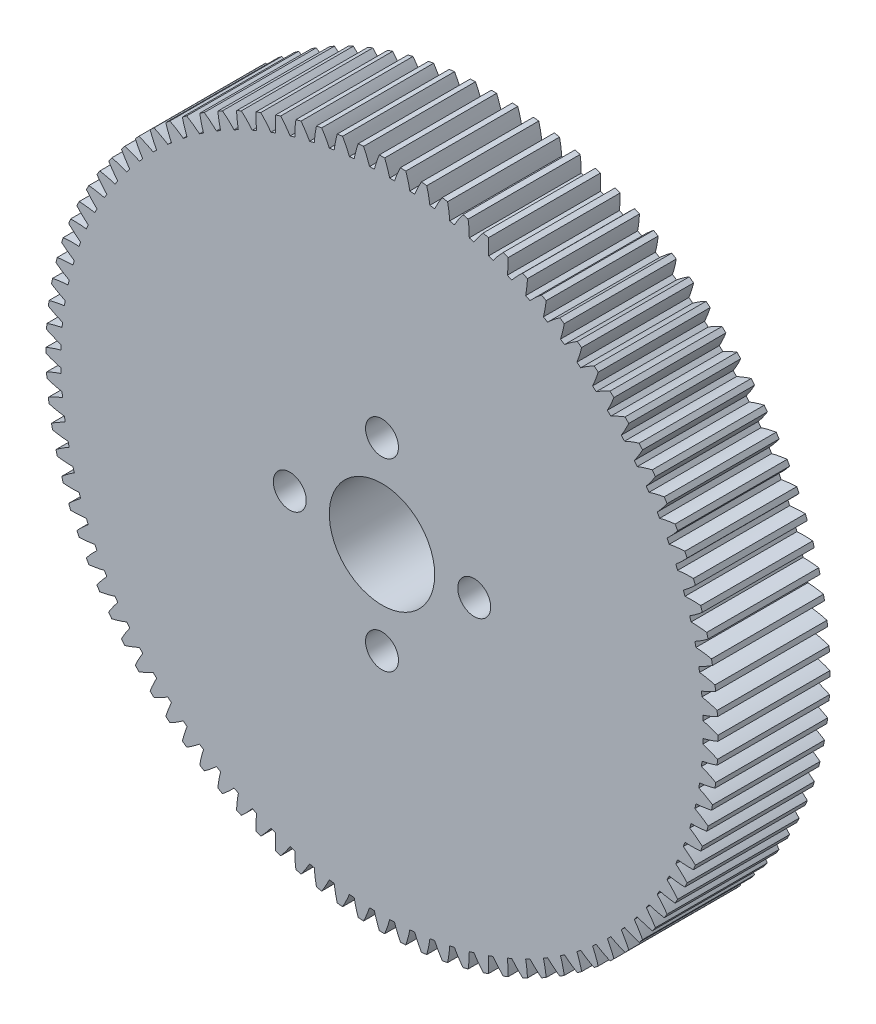
from build123d import *

# Parameters (mm, degrees)
BOSS_EXTRUDE1_DEPTH = 8.5
SKETCH2_R           = 4
SKETCH2_R_2         = 1.25
CUT_EXTRUDE1_DEPTH  = 38.0495419


with BuildPart() as part:
    # Sketch1 → Boss-Extrude1 (new body)
    with BuildSketch(Plane.XY.offset(4)):
        with BuildLine():
            Line((25.499201507, -0.201798183), (25.499201507, 0.201798183))
            ThreePointArc((25.499201507, 0.201798183), (24.94053741, 0.412222952), (24.368062617, 0.581506053))
            ThreePointArc((24.368062617, 0.581506053), (24.362972409, 0.765637253), (24.356490879, 0.949724728))
            ThreePointArc((24.356490879, 0.949724728), (24.917148309, 1.154763051), (25.46155567, 1.39970813))
            Line((25.46155567, 1.39970813), (25.436213645, 1.802508091))
            ThreePointArc((25.436213645, 1.802508091), (24.865439263, 1.977438825), (24.283464745, 2.110441895))
            ThreePointArc((24.283464745, 2.110441895), (24.266822887, 2.293890137), (24.248795199, 2.47720738))
            ThreePointArc((24.248795199, 2.47720738), (24.795471836, 2.717045077), (25.323424706, 2.995690434))
            Line((25.323424706, 2.995690434), (25.272840668, 3.396104322))
            ThreePointArc((25.272840668, 3.396104322), (24.692208588, 3.534850651), (24.103031131, 3.631048787))
            ThreePointArc((24.103031131, 3.631048787), (24.074903302, 3.813090085), (24.045400602, 3.994913625))
            ThreePointArc((24.045400602, 3.994913625), (24.575938965, 4.268604168), (25.085353753, 4.579850117))
            Line((25.085353753, 4.579850117), (25.009727335, 4.976297682))
            ThreePointArc((25.009727335, 4.976297682), (24.421529045, 5.078312037), (23.827473865, 5.137325589))
            ThreePointArc((23.827473865, 5.137325589), (23.787971072, 5.317241509), (23.747109795, 5.496853772))
            ThreePointArc((23.747109795, 5.496853772), (24.25941609, 5.803317028), (24.748282369, 6.145935223))
            Line((24.748282369, 6.145935223), (24.647912034, 6.536851868))
            ThreePointArc((24.647912034, 6.536851868), (24.054468885, 6.601731644), (23.457880446, 6.623327714))
            ThreePointArc((23.457880446, 6.623327714), (23.407158588, 6.80040821), (23.355099994, 6.977100348))
            ThreePointArc((23.355099994, 6.977100348), (23.847152382, 7.315126847), (24.313540822, 7.687765132))
            Line((24.313540822, 7.687765132), (24.188822685, 8.071608086))
            ThreePointArc((24.188822685, 8.071608086), (23.592476726, 8.099097233), (22.995709489, 8.083190589))
            ThreePointArc((22.995709489, 8.083190589), (22.933968743, 8.256736806), (22.870918284, 8.429811496))
            ThreePointArc((22.870918284, 8.429811496), (23.340774859, 8.798067203), (23.782844836, 9.199254943))
            Line((23.782844836, 9.199254943), (23.634271104, 9.574509354))
            ThreePointArc((23.634271104, 9.574509354), (23.037375839, 9.564499385), (22.442784972, 9.511152805))
            ThreePointArc((22.442784972, 9.511152805), (22.370269001, 9.680479834), (22.296475507, 9.84925403))
            ThreePointArc((22.296475507, 9.84925403), (22.742281961, 10.246285607), (23.158288827, 10.674439498))
            Line((23.158288827, 10.674439498), (22.986445852, 11.039624408))
            ThreePointArc((22.986445852, 11.039624408), (22.391356955, 10.992154828), (21.801289037, 10.901578846))
            ThreePointArc((21.801289037, 10.901578846), (21.718284027, 11.066018431), (21.634038729, 11.229826058))
            ThreePointArc((21.634038729, 11.229826058), (22.054035666, 11.654066602), (22.442337633, 12.107496917))
            Line((22.442337633, 12.107496917), (22.2479036, 12.461171109))
            ThreePointArc((22.2479036, 12.461171109), (21.656969615, 12.376429258), (21.073753374, 12.248981335))
            ThreePointArc((21.073753374, 12.248981335), (20.980586908, 12.407884509), (20.886222283, 12.566079093))
            ThreePointArc((20.886222283, 12.566079093), (21.278752168, 13.015854321), (21.637816784, 13.492771577))
            Line((21.637816784, 13.492771577), (21.421559037, 13.833539259))
            ThreePointArc((21.421559037, 13.833539259), (20.837112109, 13.711859575), (20.263049233, 13.548042691))
            ThreePointArc((20.263049233, 13.548042691), (20.160088998, 13.700782335), (20.055977459, 13.852739554))
            ThreePointArc((20.055977459, 13.852739554), (20.419491156, 14.326274409), (20.747901358, 14.824796431))
            Line((20.747901358, 14.824796431), (20.510673366, 15.151312751))
            ThreePointArc((20.510673366, 15.151312751), (19.935020042, 14.993175447), (19.372376095, 14.793636112))
            ThreePointArc((19.372376095, 14.793636112), (19.260028427, 14.939609433), (19.146580856, 15.084729581))
            ThreePointArc((19.146580856, 15.084729581), (19.479643742, 15.580155238), (19.776103444, 16.098314587))
            Line((19.776103444, 16.098314587), (19.518841438, 16.409290932))
            ThreePointArc((19.518841438, 16.409290932), (18.954253558, 16.215320106), (18.405249039, 15.98084581))
            ThreePointArc((18.405249039, 15.98084581), (18.283957322, 16.119476717), (18.161621444, 16.257187072))
            ThreePointArc((18.161621444, 16.257187072), (18.462919073, 16.772548311), (18.726258285, 17.30830005))
            Line((18.726258285, 17.30830005), (18.449977561, 17.60250914))
            ThreePointArc((18.449977561, 17.60250914), (17.898683294, 17.373470304), (17.365484873, 17.104986411))
            ThreePointArc((17.365484873, 17.104986411), (17.235727791, 17.235727791), (17.104986411, 17.365484873))
            ThreePointArc((17.104986411, 17.365484873), (17.373329697, 17.898747799), (17.60250914, 18.449977561))
            Line((17.60250914, 18.449977561), (17.30830005, 18.726258285))
            ThreePointArc((17.30830005, 18.726258285), (16.772475105, 18.463055352), (16.257187072, 18.161621444))
            ThreePointArc((16.257187072, 18.161621444), (16.119476717, 18.283957322), (15.98084581, 18.405249039))
            ThreePointArc((15.98084581, 18.405249039), (16.215175727, 18.954309106), (16.409290932, 19.518841438))
            Line((16.409290932, 19.518841438), (16.098314587, 19.776103444))
            ThreePointArc((16.098314587, 19.776103444), (15.580073619, 19.479775155), (15.084729581, 19.146580856))
            ThreePointArc((15.084729581, 19.146580856), (14.939609433, 19.260028427), (14.793636112, 19.372376095))
            ThreePointArc((14.793636112, 19.372376095), (14.993027865, 19.935066415), (15.151312751, 20.510673366))
            Line((15.151312751, 20.510673366), (14.824796431, 20.747901358))
            ThreePointArc((14.824796431, 20.747901358), (14.3261847, 20.419617185), (13.852739554, 20.055977459))
            ThreePointArc((13.852739554, 20.055977459), (13.700782335, 20.160088998), (13.548042691, 20.263049233))
            ThreePointArc((13.548042691, 20.263049233), (13.711709373, 20.837149124), (13.833539259, 21.421559037))
            Line((13.833539259, 21.421559037), (13.492771577, 21.637816784))
            ThreePointArc((13.492771577, 21.637816784), (13.015756876, 21.278872315), (12.566079093, 20.886222283))
            ThreePointArc((12.566079093, 20.886222283), (12.407884509, 20.980586908), (12.248981335, 21.073753374))
            ThreePointArc((12.248981335, 21.073753374), (12.376277027, 21.656997125), (12.461171109, 22.2479036))
            Line((12.461171109, 22.2479036), (12.107496917, 22.442337633))
            ThreePointArc((12.107496917, 22.442337633), (11.653961805, 22.054149458), (11.229826058, 21.634038729))
            ThreePointArc((11.229826058, 21.634038729), (11.066018431, 21.718284027), (10.901578846, 21.801289037))
            ThreePointArc((10.901578846, 21.801289037), (10.992001171, 22.391374853), (11.039624408, 22.986445852))
            Line((11.039624408, 22.986445852), (10.674439498, 23.158288827))
            ThreePointArc((10.674439498, 23.158288827), (10.246173871, 22.742388948), (9.84925403, 22.296475507))
            ThreePointArc((9.84925403, 22.296475507), (9.680479834, 22.370269001), (9.511152805, 22.442784972))
            ThreePointArc((9.511152805, 22.442784972), (9.564344907, 23.037384054), (9.574509354, 23.634271104))
            Line((9.574509354, 23.634271104), (9.199254943, 23.782844836))
            ThreePointArc((9.199254943, 23.782844836), (8.79794897, 23.340874619), (8.429811496, 22.870918284))
            ThreePointArc((8.429811496, 22.870918284), (8.256736806, 22.933968743), (8.083190589, 22.995709489))
            ThreePointArc((8.083190589, 22.995709489), (8.098942544, 23.592475224), (8.071608086, 24.188822685))
            Line((8.071608086, 24.188822685), (7.687765132, 24.313540822))
            ThreePointArc((7.687765132, 24.313540822), (7.315002584, 23.847244521), (6.977100348, 23.355099994))
            ThreePointArc((6.977100348, 23.355099994), (6.80040821, 23.407158588), (6.623327714, 23.457880446))
            ThreePointArc((6.623327714, 23.457880446), (6.601577355, 24.054457674), (6.536851868, 24.647912034))
            Line((6.536851868, 24.647912034), (6.145935223, 24.748282369))
            ThreePointArc((6.145935223, 24.748282369), (5.803187224, 24.259500244), (5.496853772, 23.747109795))
            ThreePointArc((5.496853772, 23.747109795), (5.317241509, 23.787971072), (5.137325589, 23.827473865))
            ThreePointArc((5.137325589, 23.827473865), (5.078158755, 24.421508168), (4.976297682, 25.009727335))
            Line((4.976297682, 25.009727335), (4.579850117, 25.085353753))
            ThreePointArc((4.579850117, 25.085353753), (4.268469336, 24.576014803), (3.994913625, 24.045400602))
            ThreePointArc((3.994913625, 24.045400602), (3.813090085, 24.074903302), (3.631048787, 24.103031131))
            ThreePointArc((3.631048787, 24.103031131), (3.534698983, 24.692178127), (3.396104322, 25.272840668))
            Line((3.396104322, 25.272840668), (2.995690434, 25.323424706))
            ThreePointArc((2.995690434, 25.323424706), (2.71690575, 24.795539059), (2.47720738, 24.248795199))
            ThreePointArc((2.47720738, 24.248795199), (2.293890137, 24.266822887), (2.110441895, 24.283464745))
            ThreePointArc((2.110441895, 24.283464745), (1.97728937, 24.865399339), (1.802508091, 25.436213645))
            Line((1.802508091, 25.436213645), (1.39970813, 25.46155567))
            ThreePointArc((1.39970813, 25.46155567), (1.154619777, 24.91720665), (0.949724728, 24.356490879))
            ThreePointArc((0.949724728, 24.356490879), (0.765637253, 24.362972409), (0.581506053, 24.368062617))
            ThreePointArc((0.581506053, 24.368062617), (0.412076298, 24.94048818), (0.201798183, 25.499201507))
            Line((0.201798183, 25.499201507), (-0.201798183, 25.499201507))
            ThreePointArc((-0.201798183, 25.499201507), (-0.412222952, 24.94053741), (-0.581506053, 24.368062617))
            ThreePointArc((-0.581506053, 24.368062617), (-0.765637253, 24.362972409), (-0.949724728, 24.356490879))
            ThreePointArc((-0.949724728, 24.356490879), (-1.154763051, 24.917148309), (-1.39970813, 25.46155567))
            Line((-1.39970813, 25.46155567), (-1.802508091, 25.436213645))
            ThreePointArc((-1.802508091, 25.436213645), (-1.977438825, 24.865439263), (-2.110441895, 24.283464745))
            ThreePointArc((-2.110441895, 24.283464745), (-2.293890137, 24.266822887), (-2.47720738, 24.248795199))
            ThreePointArc((-2.47720738, 24.248795199), (-2.717045077, 24.795471836), (-2.995690434, 25.323424706))
            Line((-2.995690434, 25.323424706), (-3.396104322, 25.272840668))
            ThreePointArc((-3.396104322, 25.272840668), (-3.534850651, 24.692208588), (-3.631048787, 24.103031131))
            ThreePointArc((-3.631048787, 24.103031131), (-3.813090085, 24.074903302), (-3.994913625, 24.045400602))
            ThreePointArc((-3.994913625, 24.045400602), (-4.268604168, 24.575938965), (-4.579850117, 25.085353753))
            Line((-4.579850117, 25.085353753), (-4.976297682, 25.009727335))
            ThreePointArc((-4.976297682, 25.009727335), (-5.078312037, 24.421529045), (-5.137325589, 23.827473865))
            ThreePointArc((-5.137325589, 23.827473865), (-5.317241509, 23.787971072), (-5.496853772, 23.747109795))
            ThreePointArc((-5.496853772, 23.747109795), (-5.803317028, 24.25941609), (-6.145935223, 24.748282369))
            Line((-6.145935223, 24.748282369), (-6.536851868, 24.647912034))
            ThreePointArc((-6.536851868, 24.647912034), (-6.601731644, 24.054468885), (-6.623327714, 23.457880446))
            ThreePointArc((-6.623327714, 23.457880446), (-6.80040821, 23.407158588), (-6.977100348, 23.355099994))
            ThreePointArc((-6.977100348, 23.355099994), (-7.315126847, 23.847152382), (-7.687765132, 24.313540822))
            Line((-7.687765132, 24.313540822), (-8.071608086, 24.188822685))
            ThreePointArc((-8.071608086, 24.188822685), (-8.099097233, 23.592476726), (-8.083190589, 22.995709489))
            ThreePointArc((-8.083190589, 22.995709489), (-8.256736806, 22.933968743), (-8.429811496, 22.870918284))
            ThreePointArc((-8.429811496, 22.870918284), (-8.798067203, 23.340774859), (-9.199254943, 23.782844836))
            Line((-9.199254943, 23.782844836), (-9.574509354, 23.634271104))
            ThreePointArc((-9.574509354, 23.634271104), (-9.564499385, 23.037375839), (-9.511152805, 22.442784972))
            ThreePointArc((-9.511152805, 22.442784972), (-9.680479834, 22.370269001), (-9.84925403, 22.296475507))
            ThreePointArc((-9.84925403, 22.296475507), (-10.246285607, 22.742281961), (-10.674439498, 23.158288827))
            Line((-10.674439498, 23.158288827), (-11.039624408, 22.986445852))
            ThreePointArc((-11.039624408, 22.986445852), (-10.992154828, 22.391356955), (-10.901578846, 21.801289037))
            ThreePointArc((-10.901578846, 21.801289037), (-11.066018431, 21.718284027), (-11.229826058, 21.634038729))
            ThreePointArc((-11.229826058, 21.634038729), (-11.654066602, 22.054035666), (-12.107496917, 22.442337633))
            Line((-12.107496917, 22.442337633), (-12.461171109, 22.2479036))
            ThreePointArc((-12.461171109, 22.2479036), (-12.376429258, 21.656969615), (-12.248981335, 21.073753374))
            ThreePointArc((-12.248981335, 21.073753374), (-12.407884509, 20.980586908), (-12.566079093, 20.886222283))
            ThreePointArc((-12.566079093, 20.886222283), (-13.015854321, 21.278752168), (-13.492771577, 21.637816784))
            Line((-13.492771577, 21.637816784), (-13.833539259, 21.421559037))
            ThreePointArc((-13.833539259, 21.421559037), (-13.711859575, 20.837112109), (-13.548042691, 20.263049233))
            ThreePointArc((-13.548042691, 20.263049233), (-13.700782335, 20.160088998), (-13.852739554, 20.055977459))
            ThreePointArc((-13.852739554, 20.055977459), (-14.326274409, 20.419491156), (-14.824796431, 20.747901358))
            Line((-14.824796431, 20.747901358), (-15.151312751, 20.510673366))
            ThreePointArc((-15.151312751, 20.510673366), (-14.993175447, 19.935020042), (-14.793636112, 19.372376095))
            ThreePointArc((-14.793636112, 19.372376095), (-14.939609433, 19.260028427), (-15.084729581, 19.146580856))
            ThreePointArc((-15.084729581, 19.146580856), (-15.580155238, 19.479643742), (-16.098314587, 19.776103444))
            Line((-16.098314587, 19.776103444), (-16.409290932, 19.518841438))
            ThreePointArc((-16.409290932, 19.518841438), (-16.215320106, 18.954253558), (-15.98084581, 18.405249039))
            ThreePointArc((-15.98084581, 18.405249039), (-16.119476717, 18.283957322), (-16.257187072, 18.161621444))
            ThreePointArc((-16.257187072, 18.161621444), (-16.772548311, 18.462919073), (-17.30830005, 18.726258285))
            Line((-17.30830005, 18.726258285), (-17.60250914, 18.449977561))
            ThreePointArc((-17.60250914, 18.449977561), (-17.373470304, 17.898683294), (-17.104986411, 17.365484873))
            ThreePointArc((-17.104986411, 17.365484873), (-17.235727791, 17.235727791), (-17.365484873, 17.104986411))
            ThreePointArc((-17.365484873, 17.104986411), (-17.898747799, 17.373329697), (-18.449977561, 17.60250914))
            Line((-18.449977561, 17.60250914), (-18.726258285, 17.30830005))
            ThreePointArc((-18.726258285, 17.30830005), (-18.463055352, 16.772475105), (-18.161621444, 16.257187072))
            ThreePointArc((-18.161621444, 16.257187072), (-18.283957322, 16.119476717), (-18.405249039, 15.98084581))
            ThreePointArc((-18.405249039, 15.98084581), (-18.954309106, 16.215175727), (-19.518841438, 16.409290932))
            Line((-19.518841438, 16.409290932), (-19.776103444, 16.098314587))
            ThreePointArc((-19.776103444, 16.098314587), (-19.479775155, 15.580073619), (-19.146580856, 15.084729581))
            ThreePointArc((-19.146580856, 15.084729581), (-19.260028427, 14.939609433), (-19.372376095, 14.793636112))
            ThreePointArc((-19.372376095, 14.793636112), (-19.935066415, 14.993027865), (-20.510673366, 15.151312751))
            Line((-20.510673366, 15.151312751), (-20.747901358, 14.824796431))
            ThreePointArc((-20.747901358, 14.824796431), (-20.419617185, 14.3261847), (-20.055977459, 13.852739554))
            ThreePointArc((-20.055977459, 13.852739554), (-20.160088998, 13.700782335), (-20.263049233, 13.548042691))
            ThreePointArc((-20.263049233, 13.548042691), (-20.837149124, 13.711709373), (-21.421559037, 13.833539259))
            Line((-21.421559037, 13.833539259), (-21.637816784, 13.492771577))
            ThreePointArc((-21.637816784, 13.492771577), (-21.278872315, 13.015756876), (-20.886222283, 12.566079093))
            ThreePointArc((-20.886222283, 12.566079093), (-20.980586908, 12.407884509), (-21.073753374, 12.248981335))
            ThreePointArc((-21.073753374, 12.248981335), (-21.656997125, 12.376277027), (-22.2479036, 12.461171109))
            Line((-22.2479036, 12.461171109), (-22.442337633, 12.107496917))
            ThreePointArc((-22.442337633, 12.107496917), (-22.054149458, 11.653961805), (-21.634038729, 11.229826058))
            ThreePointArc((-21.634038729, 11.229826058), (-21.718284027, 11.066018431), (-21.801289037, 10.901578846))
            ThreePointArc((-21.801289037, 10.901578846), (-22.391374853, 10.992001171), (-22.986445852, 11.039624408))
            Line((-22.986445852, 11.039624408), (-23.158288827, 10.674439498))
            ThreePointArc((-23.158288827, 10.674439498), (-22.742388948, 10.246173871), (-22.296475507, 9.84925403))
            ThreePointArc((-22.296475507, 9.84925403), (-22.370269001, 9.680479834), (-22.442784972, 9.511152805))
            ThreePointArc((-22.442784972, 9.511152805), (-23.037384054, 9.564344907), (-23.634271104, 9.574509354))
            Line((-23.634271104, 9.574509354), (-23.782844836, 9.199254943))
            ThreePointArc((-23.782844836, 9.199254943), (-23.340874619, 8.79794897), (-22.870918284, 8.429811496))
            ThreePointArc((-22.870918284, 8.429811496), (-22.933968743, 8.256736806), (-22.995709489, 8.083190589))
            ThreePointArc((-22.995709489, 8.083190589), (-23.592475224, 8.098942544), (-24.188822685, 8.071608086))
            Line((-24.188822685, 8.071608086), (-24.313540822, 7.687765132))
            ThreePointArc((-24.313540822, 7.687765132), (-23.847244521, 7.315002584), (-23.355099994, 6.977100348))
            ThreePointArc((-23.355099994, 6.977100348), (-23.407158588, 6.80040821), (-23.457880446, 6.623327714))
            ThreePointArc((-23.457880446, 6.623327714), (-24.054457674, 6.601577355), (-24.647912034, 6.536851868))
            Line((-24.647912034, 6.536851868), (-24.748282369, 6.145935223))
            ThreePointArc((-24.748282369, 6.145935223), (-24.259500244, 5.803187224), (-23.747109795, 5.496853772))
            ThreePointArc((-23.747109795, 5.496853772), (-23.787971072, 5.317241509), (-23.827473865, 5.137325589))
            ThreePointArc((-23.827473865, 5.137325589), (-24.421508168, 5.078158755), (-25.009727335, 4.976297682))
            Line((-25.009727335, 4.976297682), (-25.085353753, 4.579850117))
            ThreePointArc((-25.085353753, 4.579850117), (-24.576014803, 4.268469336), (-24.045400602, 3.994913625))
            ThreePointArc((-24.045400602, 3.994913625), (-24.074903302, 3.813090085), (-24.103031131, 3.631048787))
            ThreePointArc((-24.103031131, 3.631048787), (-24.692178127, 3.534698983), (-25.272840668, 3.396104322))
            Line((-25.272840668, 3.396104322), (-25.323424706, 2.995690434))
            ThreePointArc((-25.323424706, 2.995690434), (-24.795539059, 2.71690575), (-24.248795199, 2.47720738))
            ThreePointArc((-24.248795199, 2.47720738), (-24.266822887, 2.293890137), (-24.283464745, 2.110441895))
            ThreePointArc((-24.283464745, 2.110441895), (-24.865399339, 1.97728937), (-25.436213645, 1.802508091))
            Line((-25.436213645, 1.802508091), (-25.46155567, 1.39970813))
            ThreePointArc((-25.46155567, 1.39970813), (-24.91720665, 1.154619777), (-24.356490879, 0.949724728))
            ThreePointArc((-24.356490879, 0.949724728), (-24.362972409, 0.765637253), (-24.368062617, 0.581506053))
            ThreePointArc((-24.368062617, 0.581506053), (-24.94048818, 0.412076298), (-25.499201507, 0.201798183))
            Line((-25.499201507, 0.201798183), (-25.499201507, -0.201798183))
            ThreePointArc((-25.499201507, -0.201798183), (-24.94053741, -0.412222952), (-24.368062617, -0.581506053))
            ThreePointArc((-24.368062617, -0.581506053), (-24.362972409, -0.765637253), (-24.356490879, -0.949724728))
            ThreePointArc((-24.356490879, -0.949724728), (-24.917148309, -1.154763051), (-25.46155567, -1.39970813))
            Line((-25.46155567, -1.39970813), (-25.436213645, -1.802508091))
            ThreePointArc((-25.436213645, -1.802508091), (-24.865439263, -1.977438825), (-24.283464745, -2.110441895))
            ThreePointArc((-24.283464745, -2.110441895), (-24.266822887, -2.293890137), (-24.248795199, -2.47720738))
            ThreePointArc((-24.248795199, -2.47720738), (-24.795471836, -2.717045077), (-25.323424706, -2.995690434))
            Line((-25.323424706, -2.995690434), (-25.272840668, -3.396104322))
            ThreePointArc((-25.272840668, -3.396104322), (-24.692208588, -3.534850651), (-24.103031131, -3.631048787))
            ThreePointArc((-24.103031131, -3.631048787), (-24.074903302, -3.813090085), (-24.045400602, -3.994913625))
            ThreePointArc((-24.045400602, -3.994913625), (-24.575938965, -4.268604168), (-25.085353753, -4.579850117))
            Line((-25.085353753, -4.579850117), (-25.009727335, -4.976297682))
            ThreePointArc((-25.009727335, -4.976297682), (-24.421529045, -5.078312037), (-23.827473865, -5.137325589))
            ThreePointArc((-23.827473865, -5.137325589), (-23.787971072, -5.317241509), (-23.747109795, -5.496853772))
            ThreePointArc((-23.747109795, -5.496853772), (-24.25941609, -5.803317028), (-24.748282369, -6.145935223))
            Line((-24.748282369, -6.145935223), (-24.647912034, -6.536851868))
            ThreePointArc((-24.647912034, -6.536851868), (-24.054468885, -6.601731644), (-23.457880446, -6.623327714))
            ThreePointArc((-23.457880446, -6.623327714), (-23.407158588, -6.80040821), (-23.355099994, -6.977100348))
            ThreePointArc((-23.355099994, -6.977100348), (-23.847152382, -7.315126847), (-24.313540822, -7.687765132))
            Line((-24.313540822, -7.687765132), (-24.188822685, -8.071608086))
            ThreePointArc((-24.188822685, -8.071608086), (-23.592476726, -8.099097233), (-22.995709489, -8.083190589))
            ThreePointArc((-22.995709489, -8.083190589), (-22.933968743, -8.256736806), (-22.870918284, -8.429811496))
            ThreePointArc((-22.870918284, -8.429811496), (-23.340774859, -8.798067203), (-23.782844836, -9.199254943))
            Line((-23.782844836, -9.199254943), (-23.634271104, -9.574509354))
            ThreePointArc((-23.634271104, -9.574509354), (-23.037375839, -9.564499385), (-22.442784972, -9.511152805))
            ThreePointArc((-22.442784972, -9.511152805), (-22.370269001, -9.680479834), (-22.296475507, -9.84925403))
            ThreePointArc((-22.296475507, -9.84925403), (-22.742281961, -10.246285607), (-23.158288827, -10.674439498))
            Line((-23.158288827, -10.674439498), (-22.986445852, -11.039624408))
            ThreePointArc((-22.986445852, -11.039624408), (-22.391356955, -10.992154828), (-21.801289037, -10.901578846))
            ThreePointArc((-21.801289037, -10.901578846), (-21.718284027, -11.066018431), (-21.634038729, -11.229826058))
            ThreePointArc((-21.634038729, -11.229826058), (-22.054035666, -11.654066602), (-22.442337633, -12.107496917))
            Line((-22.442337633, -12.107496917), (-22.2479036, -12.461171109))
            ThreePointArc((-22.2479036, -12.461171109), (-21.656969615, -12.376429258), (-21.073753374, -12.248981335))
            ThreePointArc((-21.073753374, -12.248981335), (-20.980586908, -12.407884509), (-20.886222283, -12.566079093))
            ThreePointArc((-20.886222283, -12.566079093), (-21.278752168, -13.015854321), (-21.637816784, -13.492771577))
            Line((-21.637816784, -13.492771577), (-21.421559037, -13.833539259))
            ThreePointArc((-21.421559037, -13.833539259), (-20.837112109, -13.711859575), (-20.263049233, -13.548042691))
            ThreePointArc((-20.263049233, -13.548042691), (-20.160088998, -13.700782335), (-20.055977459, -13.852739554))
            ThreePointArc((-20.055977459, -13.852739554), (-20.419491156, -14.326274409), (-20.747901358, -14.824796431))
            Line((-20.747901358, -14.824796431), (-20.510673366, -15.151312751))
            ThreePointArc((-20.510673366, -15.151312751), (-19.935020042, -14.993175447), (-19.372376095, -14.793636112))
            ThreePointArc((-19.372376095, -14.793636112), (-19.260028427, -14.939609433), (-19.146580856, -15.084729581))
            ThreePointArc((-19.146580856, -15.084729581), (-19.479643742, -15.580155238), (-19.776103444, -16.098314587))
            Line((-19.776103444, -16.098314587), (-19.518841438, -16.409290932))
            ThreePointArc((-19.518841438, -16.409290932), (-18.954253558, -16.215320106), (-18.405249039, -15.98084581))
            ThreePointArc((-18.405249039, -15.98084581), (-18.283957322, -16.119476717), (-18.161621444, -16.257187072))
            ThreePointArc((-18.161621444, -16.257187072), (-18.462919073, -16.772548311), (-18.726258285, -17.30830005))
            Line((-18.726258285, -17.30830005), (-18.449977561, -17.60250914))
            ThreePointArc((-18.449977561, -17.60250914), (-17.898683294, -17.373470304), (-17.365484873, -17.104986411))
            ThreePointArc((-17.365484873, -17.104986411), (-17.235727791, -17.235727791), (-17.104986411, -17.365484873))
            ThreePointArc((-17.104986411, -17.365484873), (-17.373329697, -17.898747799), (-17.60250914, -18.449977561))
            Line((-17.60250914, -18.449977561), (-17.30830005, -18.726258285))
            ThreePointArc((-17.30830005, -18.726258285), (-16.772475105, -18.463055352), (-16.257187072, -18.161621444))
            ThreePointArc((-16.257187072, -18.161621444), (-16.119476717, -18.283957322), (-15.98084581, -18.405249039))
            ThreePointArc((-15.98084581, -18.405249039), (-16.215175727, -18.954309106), (-16.409290932, -19.518841438))
            Line((-16.409290932, -19.518841438), (-16.098314587, -19.776103444))
            ThreePointArc((-16.098314587, -19.776103444), (-15.580073619, -19.479775155), (-15.084729581, -19.146580856))
            ThreePointArc((-15.084729581, -19.146580856), (-14.939609433, -19.260028427), (-14.793636112, -19.372376095))
            ThreePointArc((-14.793636112, -19.372376095), (-14.993027865, -19.935066415), (-15.151312751, -20.510673366))
            Line((-15.151312751, -20.510673366), (-14.824796431, -20.747901358))
            ThreePointArc((-14.824796431, -20.747901358), (-14.3261847, -20.419617185), (-13.852739554, -20.055977459))
            ThreePointArc((-13.852739554, -20.055977459), (-13.700782335, -20.160088998), (-13.548042691, -20.263049233))
            ThreePointArc((-13.548042691, -20.263049233), (-13.711709373, -20.837149124), (-13.833539259, -21.421559037))
            Line((-13.833539259, -21.421559037), (-13.492771577, -21.637816784))
            ThreePointArc((-13.492771577, -21.637816784), (-13.015756876, -21.278872315), (-12.566079093, -20.886222283))
            ThreePointArc((-12.566079093, -20.886222283), (-12.407884509, -20.980586908), (-12.248981335, -21.073753374))
            ThreePointArc((-12.248981335, -21.073753374), (-12.376277027, -21.656997125), (-12.461171109, -22.2479036))
            Line((-12.461171109, -22.2479036), (-12.107496917, -22.442337633))
            ThreePointArc((-12.107496917, -22.442337633), (-11.653961805, -22.054149458), (-11.229826058, -21.634038729))
            ThreePointArc((-11.229826058, -21.634038729), (-11.066018431, -21.718284027), (-10.901578846, -21.801289037))
            ThreePointArc((-10.901578846, -21.801289037), (-10.992001171, -22.391374853), (-11.039624408, -22.986445852))
            Line((-11.039624408, -22.986445852), (-10.674439498, -23.158288827))
            ThreePointArc((-10.674439498, -23.158288827), (-10.246173871, -22.742388948), (-9.84925403, -22.296475507))
            ThreePointArc((-9.84925403, -22.296475507), (-9.680479834, -22.370269001), (-9.511152805, -22.442784972))
            ThreePointArc((-9.511152805, -22.442784972), (-9.564344907, -23.037384054), (-9.574509354, -23.634271104))
            Line((-9.574509354, -23.634271104), (-9.199254943, -23.782844836))
            ThreePointArc((-9.199254943, -23.782844836), (-8.79794897, -23.340874619), (-8.429811496, -22.870918284))
            ThreePointArc((-8.429811496, -22.870918284), (-8.256736806, -22.933968743), (-8.083190589, -22.995709489))
            ThreePointArc((-8.083190589, -22.995709489), (-8.098942544, -23.592475224), (-8.071608086, -24.188822685))
            Line((-8.071608086, -24.188822685), (-7.687765132, -24.313540822))
            ThreePointArc((-7.687765132, -24.313540822), (-7.315002584, -23.847244521), (-6.977100348, -23.355099994))
            ThreePointArc((-6.977100348, -23.355099994), (-6.80040821, -23.407158588), (-6.623327714, -23.457880446))
            ThreePointArc((-6.623327714, -23.457880446), (-6.601577355, -24.054457674), (-6.536851868, -24.647912034))
            Line((-6.536851868, -24.647912034), (-6.145935223, -24.748282369))
            ThreePointArc((-6.145935223, -24.748282369), (-5.803187224, -24.259500244), (-5.496853772, -23.747109795))
            ThreePointArc((-5.496853772, -23.747109795), (-5.317241509, -23.787971072), (-5.137325589, -23.827473865))
            ThreePointArc((-5.137325589, -23.827473865), (-5.078158755, -24.421508168), (-4.976297682, -25.009727335))
            Line((-4.976297682, -25.009727335), (-4.579850117, -25.085353753))
            ThreePointArc((-4.579850117, -25.085353753), (-4.268469336, -24.576014803), (-3.994913625, -24.045400602))
            ThreePointArc((-3.994913625, -24.045400602), (-3.813090085, -24.074903302), (-3.631048787, -24.103031131))
            ThreePointArc((-3.631048787, -24.103031131), (-3.534698983, -24.692178127), (-3.396104322, -25.272840668))
            Line((-3.396104322, -25.272840668), (-2.995690434, -25.323424706))
            ThreePointArc((-2.995690434, -25.323424706), (-2.71690575, -24.795539059), (-2.47720738, -24.248795199))
            ThreePointArc((-2.47720738, -24.248795199), (-2.293890137, -24.266822887), (-2.110441895, -24.283464745))
            ThreePointArc((-2.110441895, -24.283464745), (-1.97728937, -24.865399339), (-1.802508091, -25.436213645))
            Line((-1.802508091, -25.436213645), (-1.39970813, -25.46155567))
            ThreePointArc((-1.39970813, -25.46155567), (-1.154619777, -24.91720665), (-0.949724728, -24.356490879))
            ThreePointArc((-0.949724728, -24.356490879), (-0.765637253, -24.362972409), (-0.581506053, -24.368062617))
            ThreePointArc((-0.581506053, -24.368062617), (-0.412076298, -24.94048818), (-0.201798183, -25.499201507))
            Line((-0.201798183, -25.499201507), (0.201798183, -25.499201507))
            ThreePointArc((0.201798183, -25.499201507), (0.412222952, -24.94053741), (0.581506053, -24.368062617))
            ThreePointArc((0.581506053, -24.368062617), (0.765637253, -24.362972409), (0.949724728, -24.356490879))
            ThreePointArc((0.949724728, -24.356490879), (1.154763051, -24.917148309), (1.39970813, -25.46155567))
            Line((1.39970813, -25.46155567), (1.802508091, -25.436213645))
            ThreePointArc((1.802508091, -25.436213645), (1.977438825, -24.865439263), (2.110441895, -24.283464745))
            ThreePointArc((2.110441895, -24.283464745), (2.293890137, -24.266822887), (2.47720738, -24.248795199))
            ThreePointArc((2.47720738, -24.248795199), (2.717045077, -24.795471836), (2.995690434, -25.323424706))
            Line((2.995690434, -25.323424706), (3.396104322, -25.272840668))
            ThreePointArc((3.396104322, -25.272840668), (3.534850651, -24.692208588), (3.631048787, -24.103031131))
            ThreePointArc((3.631048787, -24.103031131), (3.813090085, -24.074903302), (3.994913625, -24.045400602))
            ThreePointArc((3.994913625, -24.045400602), (4.268604168, -24.575938965), (4.579850117, -25.085353753))
            Line((4.579850117, -25.085353753), (4.976297682, -25.009727335))
            ThreePointArc((4.976297682, -25.009727335), (5.078312037, -24.421529045), (5.137325589, -23.827473865))
            ThreePointArc((5.137325589, -23.827473865), (5.317241509, -23.787971072), (5.496853772, -23.747109795))
            ThreePointArc((5.496853772, -23.747109795), (5.803317028, -24.25941609), (6.145935223, -24.748282369))
            Line((6.145935223, -24.748282369), (6.536851868, -24.647912034))
            ThreePointArc((6.536851868, -24.647912034), (6.601731644, -24.054468885), (6.623327714, -23.457880446))
            ThreePointArc((6.623327714, -23.457880446), (6.80040821, -23.407158588), (6.977100348, -23.355099994))
            ThreePointArc((6.977100348, -23.355099994), (7.315126847, -23.847152382), (7.687765132, -24.313540822))
            Line((7.687765132, -24.313540822), (8.071608086, -24.188822685))
            ThreePointArc((8.071608086, -24.188822685), (8.099097233, -23.592476726), (8.083190589, -22.995709489))
            ThreePointArc((8.083190589, -22.995709489), (8.256736806, -22.933968743), (8.429811496, -22.870918284))
            ThreePointArc((8.429811496, -22.870918284), (8.798067203, -23.340774859), (9.199254943, -23.782844836))
            Line((9.199254943, -23.782844836), (9.574509354, -23.634271104))
            ThreePointArc((9.574509354, -23.634271104), (9.564499385, -23.037375839), (9.511152805, -22.442784972))
            ThreePointArc((9.511152805, -22.442784972), (9.680479834, -22.370269001), (9.84925403, -22.296475507))
            ThreePointArc((9.84925403, -22.296475507), (10.246285607, -22.742281961), (10.674439498, -23.158288827))
            Line((10.674439498, -23.158288827), (11.039624408, -22.986445852))
            ThreePointArc((11.039624408, -22.986445852), (10.992154828, -22.391356955), (10.901578846, -21.801289037))
            ThreePointArc((10.901578846, -21.801289037), (11.066018431, -21.718284027), (11.229826058, -21.634038729))
            ThreePointArc((11.229826058, -21.634038729), (11.654066602, -22.054035666), (12.107496917, -22.442337633))
            Line((12.107496917, -22.442337633), (12.461171109, -22.2479036))
            ThreePointArc((12.461171109, -22.2479036), (12.376429258, -21.656969615), (12.248981335, -21.073753374))
            ThreePointArc((12.248981335, -21.073753374), (12.407884509, -20.980586908), (12.566079093, -20.886222283))
            ThreePointArc((12.566079093, -20.886222283), (13.015854321, -21.278752168), (13.492771577, -21.637816784))
            Line((13.492771577, -21.637816784), (13.833539259, -21.421559037))
            ThreePointArc((13.833539259, -21.421559037), (13.711859575, -20.837112109), (13.548042691, -20.263049233))
            ThreePointArc((13.548042691, -20.263049233), (13.700782335, -20.160088998), (13.852739554, -20.055977459))
            ThreePointArc((13.852739554, -20.055977459), (14.326274409, -20.419491156), (14.824796431, -20.747901358))
            Line((14.824796431, -20.747901358), (15.151312751, -20.510673366))
            ThreePointArc((15.151312751, -20.510673366), (14.993175447, -19.935020042), (14.793636112, -19.372376095))
            ThreePointArc((14.793636112, -19.372376095), (14.939609433, -19.260028427), (15.084729581, -19.146580856))
            ThreePointArc((15.084729581, -19.146580856), (15.580155238, -19.479643742), (16.098314587, -19.776103444))
            Line((16.098314587, -19.776103444), (16.409290932, -19.518841438))
            ThreePointArc((16.409290932, -19.518841438), (16.215320106, -18.954253558), (15.98084581, -18.405249039))
            ThreePointArc((15.98084581, -18.405249039), (16.119476717, -18.283957322), (16.257187072, -18.161621444))
            ThreePointArc((16.257187072, -18.161621444), (16.772548311, -18.462919073), (17.30830005, -18.726258285))
            Line((17.30830005, -18.726258285), (17.60250914, -18.449977561))
            ThreePointArc((17.60250914, -18.449977561), (17.373470304, -17.898683294), (17.104986411, -17.365484873))
            ThreePointArc((17.104986411, -17.365484873), (17.235727791, -17.235727791), (17.365484873, -17.104986411))
            ThreePointArc((17.365484873, -17.104986411), (17.898747799, -17.373329697), (18.449977561, -17.60250914))
            Line((18.449977561, -17.60250914), (18.726258285, -17.30830005))
            ThreePointArc((18.726258285, -17.30830005), (18.463055352, -16.772475105), (18.161621444, -16.257187072))
            ThreePointArc((18.161621444, -16.257187072), (18.283957322, -16.119476717), (18.405249039, -15.98084581))
            ThreePointArc((18.405249039, -15.98084581), (18.954309106, -16.215175727), (19.518841438, -16.409290932))
            Line((19.518841438, -16.409290932), (19.776103444, -16.098314587))
            ThreePointArc((19.776103444, -16.098314587), (19.479775155, -15.580073619), (19.146580856, -15.084729581))
            ThreePointArc((19.146580856, -15.084729581), (19.260028427, -14.939609433), (19.372376095, -14.793636112))
            ThreePointArc((19.372376095, -14.793636112), (19.935066415, -14.993027865), (20.510673366, -15.151312751))
            Line((20.510673366, -15.151312751), (20.747901358, -14.824796431))
            ThreePointArc((20.747901358, -14.824796431), (20.419617185, -14.3261847), (20.055977459, -13.852739554))
            ThreePointArc((20.055977459, -13.852739554), (20.160088998, -13.700782335), (20.263049233, -13.548042691))
            ThreePointArc((20.263049233, -13.548042691), (20.837149124, -13.711709373), (21.421559037, -13.833539259))
            Line((21.421559037, -13.833539259), (21.637816784, -13.492771577))
            ThreePointArc((21.637816784, -13.492771577), (21.278872315, -13.015756876), (20.886222283, -12.566079093))
            ThreePointArc((20.886222283, -12.566079093), (20.980586908, -12.407884509), (21.073753374, -12.248981335))
            ThreePointArc((21.073753374, -12.248981335), (21.656997125, -12.376277027), (22.2479036, -12.461171109))
            Line((22.2479036, -12.461171109), (22.442337633, -12.107496917))
            ThreePointArc((22.442337633, -12.107496917), (22.054149458, -11.653961805), (21.634038729, -11.229826058))
            ThreePointArc((21.634038729, -11.229826058), (21.718284027, -11.066018431), (21.801289037, -10.901578846))
            ThreePointArc((21.801289037, -10.901578846), (22.391374853, -10.992001171), (22.986445852, -11.039624408))
            Line((22.986445852, -11.039624408), (23.158288827, -10.674439498))
            ThreePointArc((23.158288827, -10.674439498), (22.742388948, -10.246173871), (22.296475507, -9.84925403))
            ThreePointArc((22.296475507, -9.84925403), (22.370269001, -9.680479834), (22.442784972, -9.511152805))
            ThreePointArc((22.442784972, -9.511152805), (23.037384054, -9.564344907), (23.634271104, -9.574509354))
            Line((23.634271104, -9.574509354), (23.782844836, -9.199254943))
            ThreePointArc((23.782844836, -9.199254943), (23.340874619, -8.79794897), (22.870918284, -8.429811496))
            ThreePointArc((22.870918284, -8.429811496), (22.933968743, -8.256736806), (22.995709489, -8.083190589))
            ThreePointArc((22.995709489, -8.083190589), (23.592475224, -8.098942544), (24.188822685, -8.071608086))
            Line((24.188822685, -8.071608086), (24.313540822, -7.687765132))
            ThreePointArc((24.313540822, -7.687765132), (23.847244521, -7.315002584), (23.355099994, -6.977100348))
            ThreePointArc((23.355099994, -6.977100348), (23.407158588, -6.80040821), (23.457880446, -6.623327714))
            ThreePointArc((23.457880446, -6.623327714), (24.054457674, -6.601577355), (24.647912034, -6.536851868))
            Line((24.647912034, -6.536851868), (24.748282369, -6.145935223))
            ThreePointArc((24.748282369, -6.145935223), (24.259500244, -5.803187224), (23.747109795, -5.496853772))
            ThreePointArc((23.747109795, -5.496853772), (23.787971072, -5.317241509), (23.827473865, -5.137325589))
            ThreePointArc((23.827473865, -5.137325589), (24.421508168, -5.078158755), (25.009727335, -4.976297682))
            Line((25.009727335, -4.976297682), (25.085353753, -4.579850117))
            ThreePointArc((25.085353753, -4.579850117), (24.576014803, -4.268469336), (24.045400602, -3.994913625))
            ThreePointArc((24.045400602, -3.994913625), (24.074903302, -3.813090085), (24.103031131, -3.631048787))
            ThreePointArc((24.103031131, -3.631048787), (24.692178127, -3.534698983), (25.272840668, -3.396104322))
            Line((25.272840668, -3.396104322), (25.323424706, -2.995690434))
            ThreePointArc((25.323424706, -2.995690434), (24.795539059, -2.71690575), (24.248795199, -2.47720738))
            ThreePointArc((24.248795199, -2.47720738), (24.266822887, -2.293890137), (24.283464745, -2.110441895))
            ThreePointArc((24.283464745, -2.110441895), (24.865399339, -1.97728937), (25.436213645, -1.802508091))
            Line((25.436213645, -1.802508091), (25.46155567, -1.39970813))
            ThreePointArc((25.46155567, -1.39970813), (24.91720665, -1.154619777), (24.356490879, -0.949724728))
            ThreePointArc((24.356490879, -0.949724728), (24.362972409, -0.765637253), (24.368062617, -0.581506053))
            ThreePointArc((24.368062617, -0.581506053), (24.94048818, -0.412076298), (25.499201507, -0.201798183))
        make_face()
    extrude(amount=-BOSS_EXTRUDE1_DEPTH)

    # Sketch2 → Cut-Extrude1 (cut, through all)
    with BuildSketch(Plane.XY.offset(4)):
        Circle(SKETCH2_R)
        with Locations((0, 7)):
            Circle(SKETCH2_R_2)
        with Locations((7, 0)):
            Circle(SKETCH2_R_2)
        with Locations((0, -7)):
            Circle(SKETCH2_R_2)
        with Locations((-7, 0)):
            Circle(SKETCH2_R_2)
    extrude(amount=-CUT_EXTRUDE1_DEPTH, mode=Mode.SUBTRACT)


solid = part.part
